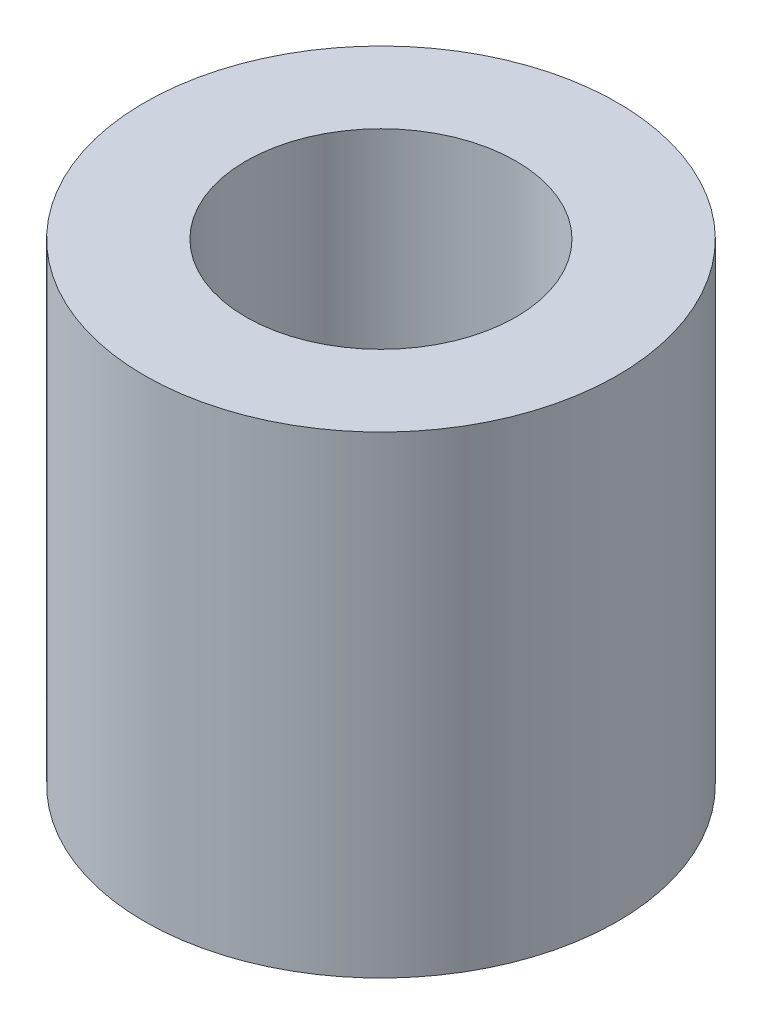
from build123d import *

# Parameters (mm, degrees)
SKETCH1_R           = 175
SKETCH1_R_2         = 100
BOSS_EXTRUDE1_DEPTH = 350
ECHELLE1_SCALE      = 0.47


with BuildPart() as part:
    # Sketch1 → Boss-Extrude1 (new body)
    with BuildSketch(Plane(origin=(0, 0, 0), x_dir=(1, 0, 0), z_dir=(0, 1, 0))):
        with Locations(Location((0, 0, 0), (0, 0, 270))):
            Circle(SKETCH1_R)
        with Locations(Location((0, 0, 0), (0, 0, 270))):
            Circle(SKETCH1_R_2, mode=Mode.SUBTRACT)
    extrude(amount=BOSS_EXTRUDE1_DEPTH)


with BuildPart() as part_1:
    # Echelle1: scaled about (0, 175, 0)
    add(part.part.scale(ECHELLE1_SCALE).moved(Location((0, 92.75, 0))))


solid = part_1.part
